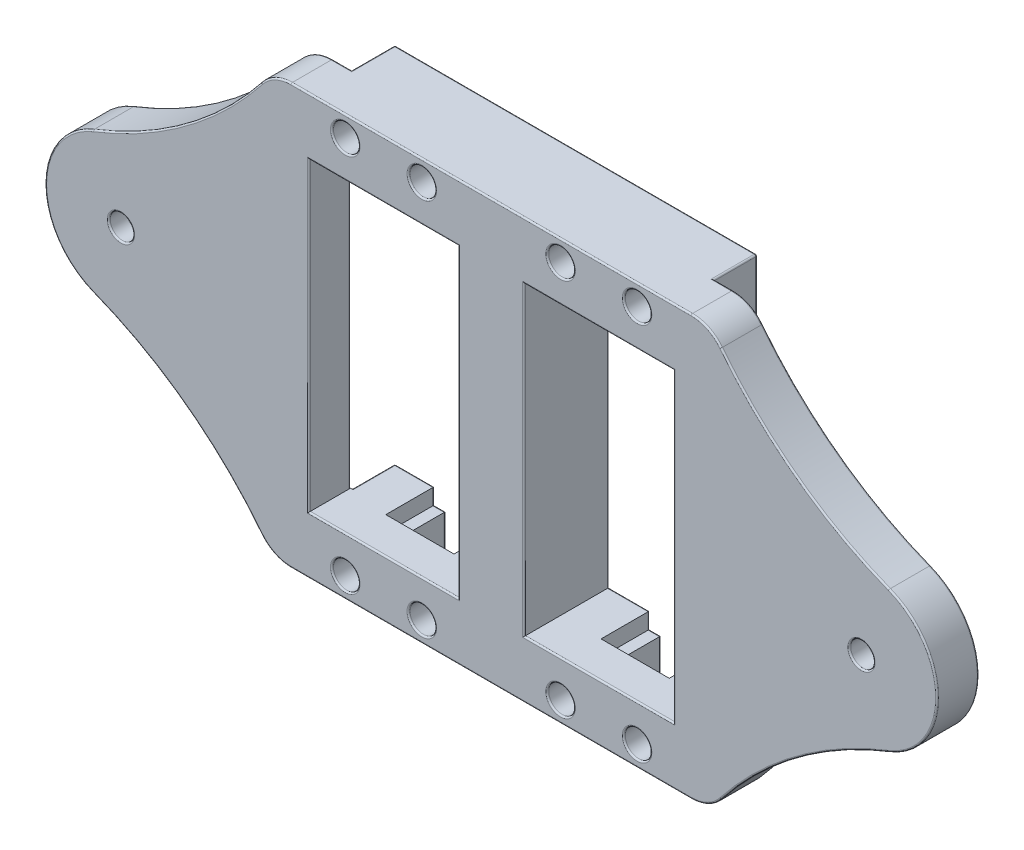
from build123d import *

# Parameters (mm, degrees)
SKETCH_1_R          = 1.1
EXTRUDE_1_DEPTH     = 5.7
SKETCH_2_W          = 19.4
SKETCH_2_H          = 40
SKETCH_2_R          = 1.6
SKETCH_2_R_2        = 1.1
EXTRUDE_2_DEPTH     = 5.5
SKETCH_3_W          = 6
SKETCH_3_H          = 5.45
CUT_EXTRUDE_1_DEPTH = 6.4
CUT_EXTRUDE_2_DEPTH = 3
SKETCH_5_R          = 1.75
CUT_EXTRUDE_3_DEPTH = 3
SKETCH_6_W          = 19.7
SKETCH_6_H          = 40.3
SKETCH_6_W_2        = 19.4
SKETCH_6_H_2        = 40
CUT_EXTRUDE_4_DEPTH = 67.002624879
FILLET_1_R          = 0.2


with BuildPart() as part:
    # 스케치1 → 보스-돌출1 (new body)
    with BuildSketch(Plane.XY):
        Polygon((-4.5, -20), (-4.5, 20), (-23.9, 20), (-23.9, 27.7), (23.9, 27.7), (23.9, 20), (4.5, 20), (4.5, -20), (23.9, -20), (23.9, -27.7), (-23.9, -27.7), (-23.9, -20), align=None)
        with Locations((-19.25, 25)):
            Circle(SKETCH_1_R, mode=Mode.SUBTRACT)
        with Locations((-19.25, -25)):
            Circle(SKETCH_1_R, mode=Mode.SUBTRACT)
        with Locations((-9.15, -25)):
            Circle(SKETCH_1_R, mode=Mode.SUBTRACT)
        with Locations((19.25, -25)):
            Circle(SKETCH_1_R, mode=Mode.SUBTRACT)
        with Locations((19.25, 25)):
            Circle(SKETCH_1_R, mode=Mode.SUBTRACT)
        with Locations((9.15, 25)):
            Circle(SKETCH_1_R, mode=Mode.SUBTRACT)
        with Locations((9.15, -25)):
            Circle(SKETCH_1_R, mode=Mode.SUBTRACT)
        with Locations((-9.15, 25)):
            Circle(SKETCH_1_R, mode=Mode.SUBTRACT)
    extrude(amount=EXTRUDE_1_DEPTH)

    # 스케치2 → 보스-돌출2 (add)
    with BuildSketch(Plane.XY.offset(5.7)):
        with BuildLine():
            Line((26.399088842, 27.7), (-26.399088842, 27.7))
            ThreePointArc((-26.399088842, 27.7), (-28.585937154, 27.196409063), (-30.332274669, 25.787077784))
            ThreePointArc((-30.332274669, 25.787077784), (-40.311933029, 16.066097966), (-52.497014243, 9.312223123))
            ThreePointArc((-52.497014243, 9.312223123), (-58.852497745, 0), (-52.497014243, -9.312223123))
            ThreePointArc((-52.497014243, -9.312223123), (-40.311933029, -16.066097966), (-30.332274669, -25.787077784))
            ThreePointArc((-30.332274669, -25.787077784), (-28.585937154, -27.196409063), (-26.399088842, -27.7))
            Line((-26.399088842, -27.7), (26.399088842, -27.7))
            ThreePointArc((26.399088842, -27.7), (28.585937154, -27.196409063), (30.332274669, -25.787077784))
            ThreePointArc((30.332274669, -25.787077784), (40.311933029, -16.066097966), (52.497014243, -9.312223123))
            ThreePointArc((52.497014243, -9.312223123), (58.852497745, 0), (52.497014243, 9.312223123))
            ThreePointArc((52.497014243, 9.312223123), (40.311933029, 16.066097966), (30.332274669, 25.787077784))
            ThreePointArc((30.332274669, 25.787077784), (28.585937154, 27.196409063), (26.399088842, 27.7))
        make_face()
        with Locations((14.2, 0)):
            Rectangle(SKETCH_2_W, SKETCH_2_H, mode=Mode.SUBTRACT)
        with Locations((-14.2, 0)):
            Rectangle(SKETCH_2_W, SKETCH_2_H, mode=Mode.SUBTRACT)
        with Locations((48.852497745, 0)):
            Circle(SKETCH_2_R, mode=Mode.SUBTRACT)
        with Locations((9.15, 25)):
            Circle(SKETCH_2_R_2, mode=Mode.SUBTRACT)
        with Locations((19.25, 25)):
            Circle(SKETCH_2_R_2, mode=Mode.SUBTRACT)
        with Locations((-19.25, -25)):
            Circle(SKETCH_2_R_2, mode=Mode.SUBTRACT)
        with Locations((-9.15, -25)):
            Circle(SKETCH_2_R_2, mode=Mode.SUBTRACT)
        with Locations((9.15, -25)):
            Circle(SKETCH_2_R_2, mode=Mode.SUBTRACT)
        with Locations((19.25, -25)):
            Circle(SKETCH_2_R_2, mode=Mode.SUBTRACT)
        with Locations((-19.25, 25)):
            Circle(SKETCH_2_R_2, mode=Mode.SUBTRACT)
        with Locations((-9.15, 25)):
            Circle(SKETCH_2_R_2, mode=Mode.SUBTRACT)
        with Locations((-48.852497745, 0)):
            Circle(SKETCH_2_R, mode=Mode.SUBTRACT)
    extrude(amount=EXTRUDE_2_DEPTH)

    # 스케치3 → 컷-돌출1 (cut)
    with BuildSketch(Plane(origin=(0, 0, 0), x_dir=(-1, 0, 0), z_dir=(0, 0, -1))):
        Polygon((-9.7, -20), (-18.7, -20), (-18.7, -22.25), (-17.2, -22.25), (-11.2, -22.25), (-9.7, -22.25), align=None)
        with Locations((-14.2, -24.975)):
            Rectangle(SKETCH_3_W, SKETCH_3_H)
        with Locations((14.2, -24.975)):
            Rectangle(SKETCH_3_W, SKETCH_3_H)
        Polygon((9.7, -22.25), (11.2, -22.25), (17.2, -22.25), (18.7, -22.25), (18.7, -20), (9.7, -20), align=None)
    extrude(amount=-CUT_EXTRUDE_1_DEPTH, mode=Mode.SUBTRACT)

    # 스케치4 → 컷-돌출2 (cut)
    with BuildSketch(Plane(origin=(0, 0, 5.7), x_dir=(-1, 0, 0), z_dir=(0, 0, -1))):
        Polygon((-48.852497745, -3.18), (-46.098536961, -1.59), (-46.098536961, 1.59), (-48.852497745, 3.18), (-51.60645853, 1.59), (-51.60645853, -1.59), align=None)
        Polygon((48.852497745, -3.18), (46.098536961, -1.59), (46.098536961, 1.59), (48.852497745, 3.18), (51.60645853, 1.59), (51.60645853, -1.59), align=None)
    extrude(amount=-CUT_EXTRUDE_2_DEPTH, mode=Mode.SUBTRACT)

    # 스케치5 → 컷-돌출3 (cut)
    with BuildSketch(Plane.XY.offset(11.2)):
        with Locations((-19.25, 25)):
            Circle(SKETCH_5_R)
        with Locations((-9.15, 25)):
            Circle(SKETCH_5_R)
        with Locations((9.15, 25)):
            Circle(SKETCH_5_R)
        with Locations((19.25, 25)):
            Circle(SKETCH_5_R)
        with Locations((-19.25, -25)):
            Circle(SKETCH_5_R)
        with Locations((-9.15, -25)):
            Circle(SKETCH_5_R)
        with Locations((9.15, -25)):
            Circle(SKETCH_5_R)
        with Locations((19.25, -25)):
            Circle(SKETCH_5_R)
    extrude(amount=-CUT_EXTRUDE_3_DEPTH, mode=Mode.SUBTRACT)

    # 스케치6 → 컷-돌출4 (cut, through all)
    # profile 1 of 2: a face of its own
    with BuildSketch(Plane.XY.offset(11.2)):
        with Locations((-14.2, 0)):
            Rectangle(SKETCH_6_W, SKETCH_6_H)
        with Locations((-14.2, 0)):
            Rectangle(SKETCH_6_W_2, SKETCH_6_H_2, mode=Mode.SUBTRACT)
    # profile 2 of 2: a face of its own
    with BuildSketch(Plane.XY.offset(11.2)):
        with Locations((14.2, 0)):
            Rectangle(SKETCH_6_W, SKETCH_6_H)
        with Locations((14.2, 0)):
            Rectangle(SKETCH_6_W_2, SKETCH_6_H_2, mode=Mode.SUBTRACT)
    extrude(amount=-CUT_EXTRUDE_4_DEPTH, mode=Mode.SUBTRACT)

    # 필렛1
    fillet_1_edges = [part.edges().sort_by_distance(p)[0] for p in [
        (0, -27.7, 0),
        (-20.55, -27.7, 0),
        (11.2, -24.975, 0),
        (17.95, -22.25, 0),
        (17.2, -24.975, 0),
        (10.45, -22.25, 0),
        (-17.2, -24.975, 0),
        (-10.45, -22.25, 0),
        (-17.95, -22.25, 0),
        (-11.2, -24.975, 0),
        (47.252497745, 0, 8.7),
        (50.229478137, -2.385, 5.7),
        (47.475517353, -2.385, 5.7),
        (46.098536961, 0, 5.7),
        (47.475517353, 2.385, 5.7),
        (50.229478137, 2.385, 5.7),
        (51.60645853, 0, 5.7),
        (-50.452497745, 0, 8.7),
        (-50.229478137, -2.385, 5.7),
        (-51.60645853, 0, 5.7),
        (-50.229478137, 2.385, 5.7),
        (-47.475517353, 2.385, 5.7),
        (-46.098536961, 0, 5.7),
        (-47.475517353, -2.385, 5.7),
        (-10.25, 25, 0),
        (8.05, -25, 0),
        (8.05, 25, 0),
        (0, 27.7, 0),
        (-20.35, -25, 8.2),
        (-21, -25, 11.2),
        (18.15, 25, 8.2),
        (17.5, 25, 11.2),
        (8.05, 25, 8.2),
        (7.4, 25, 11.2),
        (-10.9, 25, 11.2),
        (-10.25, 25, 8.2),
        (-10.25, -25, 8.2),
        (-10.9, -25, 11.2),
        (7.4, -25, 11.2),
        (8.05, -25, 8.2),
        (17.5, -25, 11.2),
        (18.15, -25, 8.2),
        (-21, 25, 11.2),
        (-20.35, 25, 8.2),
        (20.55, -27.7, 0),
        (18.15, 25, 0),
        (18.15, -25, 0),
        (-10.25, -25, 0),
        (9.7, -21.2, 0),
        (18.7, -21.2, 0),
        (-20.35, -25, 0),
        (-18.7, -21.2, 0),
        (-9.7, -21.2, 0),
        (24.05, 0, 5.7),
        (-20.35, 25, 0),
        (23.9, -23.925, 0),
        (-23.9, 23.925, 0),
        (23.9, 23.925, 0),
        (-23.9, -23.925, 0),
        (-24.05, 0, 5.7),
        (-21.3, -20.15, 0),
        (-14.125, 20.15, 0),
        (-4.35, 0, 0),
        (-7.025, -20.15, 0),
        (-14.2, -20.15, 11.2),
        (-23.9, -20.15, 2.85),
        (-23.9, 20.15, 2.85),
        (-14.2, 20.15, 11.2),
        (-4.35, 0, 11.2),
        (-24.05, 0, 11.2),
        (14.2, 20.15, 11.2),
        (7.025, -20.15, 0),
        (4.35, 0, 0),
        (14.125, 20.15, 0),
        (21.3, -20.15, 0),
        (23.9, -20.15, 2.85),
        (14.2, -20.15, 11.2),
        (4.35, 0, 11.2),
        (23.9, 20.15, 2.85),
        (24.05, 0, 11.2),
        (-23.9, 27.7, 2.85),
        (23.9, 27.7, 2.85),
        (23.9, -27.7, 2.85),
        (-23.9, -27.7, 2.85),
        (-25.149544421, -27.7, 5.7),
        (-28.585937154, -27.196409063, 5.7),
        (-58.852497745, 0, 5.7),
        (-40.311933029, 16.066097966, 5.7),
        (-28.585937154, 27.196409063, 5.7),
        (-28.585937154, 27.196409063, 11.2),
        (-40.311933029, 16.066097966, 11.2),
        (-58.852497745, 0, 11.2),
        (-40.311933029, -16.066097966, 5.7),
        (-28.585937154, -27.196409063, 11.2),
        (0, -27.7, 11.2),
        (28.585937154, -27.196409063, 5.7),
        (40.311933029, -16.066097966, 11.2),
        (58.852497745, 0, 5.7),
        (40.311933029, 16.066097966, 5.7),
        (28.585937154, 27.196409063, 5.7),
        (25.149544421, 27.7, 5.7),
        (-25.149544421, 27.7, 5.7),
        (47.252497745, 0, 11.2),
        (-40.311933029, -16.066097966, 11.2),
        (28.585937154, -27.196409063, 11.2),
        (58.852497745, 0, 11.2),
        (40.311933029, 16.066097966, 11.2),
        (28.585937154, 27.196409063, 11.2),
        (0, 27.7, 11.2),
        (-50.452497745, 0, 11.2),
        (40.311933029, -16.066097966, 5.7),
        (25.149544421, -27.7, 5.7),
    ]]
    fillet(fillet_1_edges, radius=FILLET_1_R)


solid = part.part
